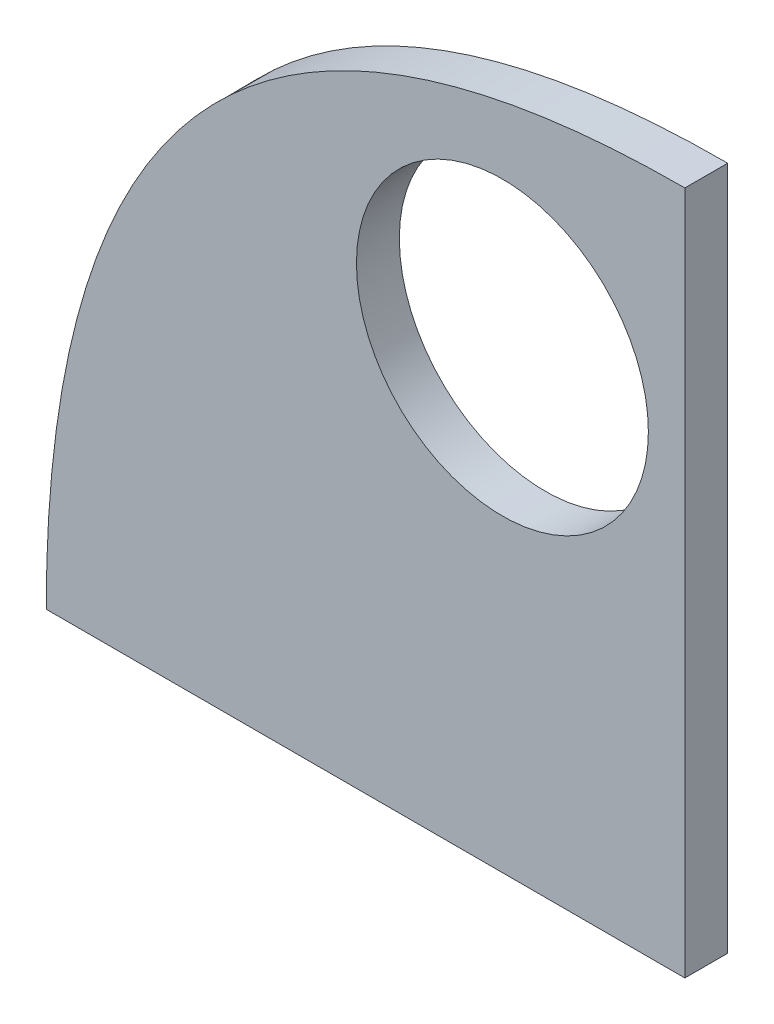
from build123d import *

# Parameters (mm, degrees)
SKETCH1_R           = 16
BOSS_EXTRUDE1_DEPTH = 4.7
CUT_EXTRUDE1_DEPTH  = 1.7


with BuildPart() as part:
    # Sketch1 → Boss-Extrude1 (new body)
    with BuildSketch(Plane.XY):
        with BuildLine():
            Line((-70, 0), (0, 0))
            Line((0, 0), (0, 75))
            add(Edge.make_bspline(
                [(0, 75), (-70, 75), (-70, 0)],
                knots=[0, 0, 0, 1, 1, 1], degree=2))
        make_face()
        with Locations((-20, 49.85)):
            Circle(SKETCH1_R, mode=Mode.SUBTRACT)
    extrude(amount=BOSS_EXTRUDE1_DEPTH)

    # Sketch1<5> → Cut-Extrude1 (cut)
    with BuildSketch(Plane.XY):
        with BuildLine():
            Line((-3.9, 13), (-18.197224362, 13))
            ThreePointArc((-18.197224362, 13), (-20, 13.5), (-21.802775638, 13))
            Line((-21.802775638, 13), (-36.1, 13))
            Line((-36.1, 13), (-36.1, 7))
            Line((-36.1, 7), (-21.802775638, 7))
            ThreePointArc((-21.802775638, 7), (-20, 6.5), (-18.197224362, 7))
            Line((-18.197224362, 7), (-3.9, 7))
            Line((-3.9, 7), (-3.9, 13))
        make_face()
    extrude(amount=CUT_EXTRUDE1_DEPTH, mode=Mode.SUBTRACT)


solid = part.part
